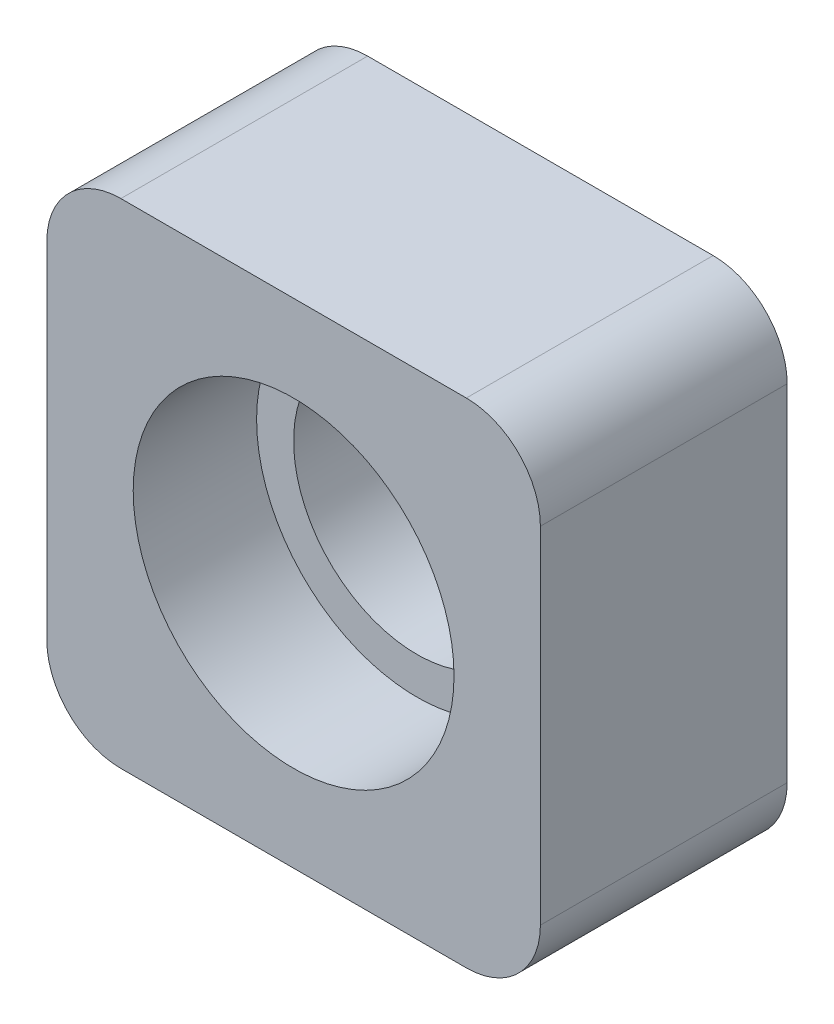
from build123d import *

# Parameters (mm, degrees)
SKETCH1_W           = 20
SKETCH1_H           = 20
BOSS_EXTRUDE1_DEPTH = 5
FILLET1_R           = 3
CUT_EXTRUDE1_REACH  = 19.321
SKETCH2_R           = 5
SKETCH3_R           = 6.5
CUT_EXTRUDE2_DEPTH  = 5


with BuildPart() as part:
    # Sketch1 → Boss-Extrude1 (new, symmetric)
    with BuildSketch(Plane.XY):
        Rectangle(SKETCH1_W, SKETCH1_H)
    extrude(amount=BOSS_EXTRUDE1_DEPTH, both=True)

    # Fillet1
    fillet1_edges = [part.edges().sort_by_distance(p)[0] for p in [
        (10, -10, 0),
        (-10, -10, 0),
        (-10, 10, 0),
        (10, 10, 0),
    ]]
    fillet(fillet1_edges, radius=FILLET1_R)

    # Sketch2 → Cut-Extrude1 (cut, up to next)
    with BuildSketch(Plane.XY.offset(5), mode=Mode.PRIVATE) as cut_extrude1_sk1:
        Circle(SKETCH2_R)
    cut_extrude1_tool1 = extrude(cut_extrude1_sk1.sketch, amount=-CUT_EXTRUDE1_REACH, mode=Mode.PRIVATE) & part.part
    add(cut_extrude1_tool1.solids().sort_by_distance((0, 0, 5))[0], mode=Mode.SUBTRACT)

    # Sketch3 → Cut-Extrude2 (cut)
    with BuildSketch(Plane.XY.offset(5)):
        Circle(SKETCH3_R)
    extrude(amount=-CUT_EXTRUDE2_DEPTH, mode=Mode.SUBTRACT)


solid = part.part
